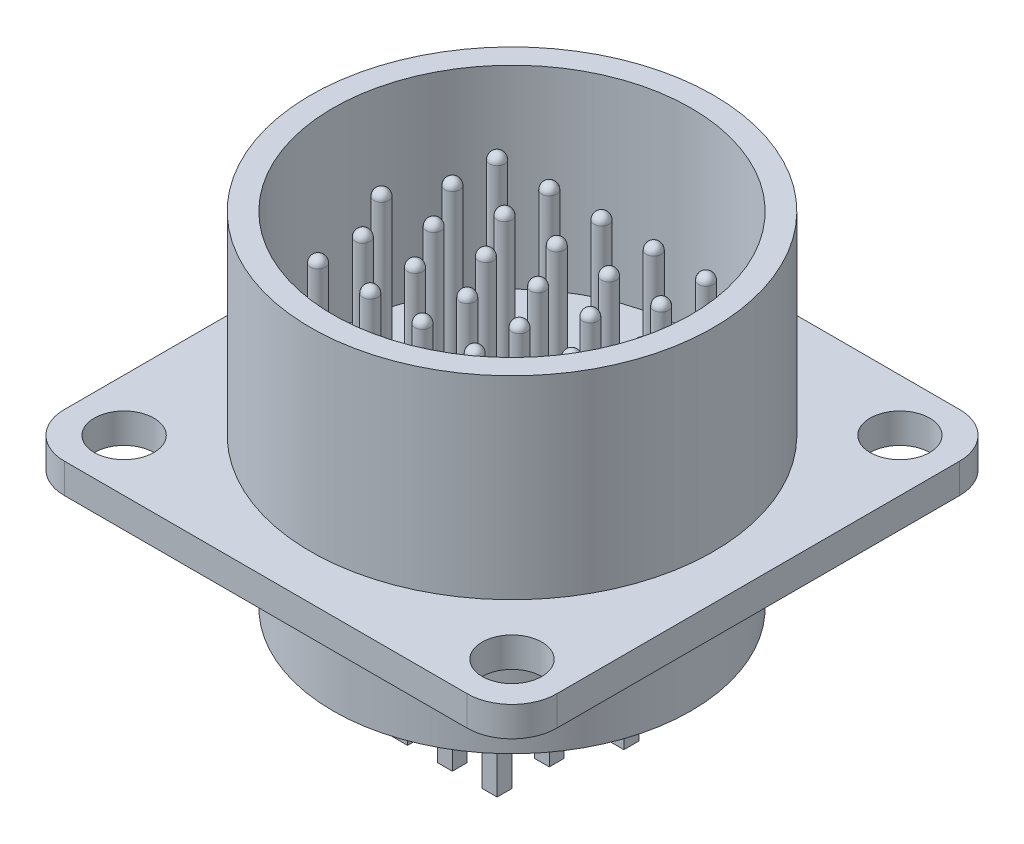
from build123d import *

# Parameters (mm, degrees)
SKETCH_1_R      = 2
EXTRUDE_1_DEPTH = 2
SKETCH_2_R      = 13.5
SKETCH_2_R_2    = 12
EXTRUDE_2_DEPTH = 13
SKETCH_3_R      = 0.5
EXTRUDE_3_DEPTH = 10
EXTRUDE_START   = 8
SKETCH_4_R      = 12
SKETCH_4_R_2    = 10.5
EXTRUDE_4_DEPTH = 8
EXTRUDE_START_2 = 4
SKETCH_5_R      = 10.5
EXTRUDE_5_DEPTH = 4
SKETCH_6_W      = 1
SKETCH_6_H      = 1
EXTRUDE_6_DEPTH = 8
FILLET_3_R      = 0.5


with BuildPart() as part:
    # Эскиз1 → Бобышка-Вытянуть1 (new body)
    with BuildSketch(Plane(origin=(0, 0, 0), x_dir=(1, 0, 0), z_dir=(0, 1, 0))):
        with BuildLine():
            Line((3, 0), (30, 0))
            ThreePointArc((30, 0), (32.121320344, 0.878679656), (33, 3))
            Line((33, 3), (33, 30))
            ThreePointArc((33, 30), (32.121320344, 32.121320344), (30, 33))
            Line((30, 33), (3, 33))
            ThreePointArc((3, 33), (0.878679656, 32.121320344), (0, 30))
            Line((0, 30), (0, 3))
            ThreePointArc((0, 3), (0.878679656, 0.878679656), (3, 0))
        make_face()
        with Locations(Location((3.5, 29.5, 0), (0, 0, 270))):
            Circle(SKETCH_1_R, mode=Mode.SUBTRACT)
        with Locations(Location((29.5, 29.5, 0), (0, 0, 270))):
            Circle(SKETCH_1_R, mode=Mode.SUBTRACT)
        with Locations(Location((3.5, 3.5, 0), (0, 0, 270))):
            Circle(SKETCH_1_R, mode=Mode.SUBTRACT)
        with Locations(Location((29.5, 3.5, 0), (0, 0, 270))):
            Circle(SKETCH_1_R, mode=Mode.SUBTRACT)
    extrude(amount=EXTRUDE_1_DEPTH)

    # Эскиз2 → Бобышка-Вытянуть2 (add)
    with BuildSketch(Plane(origin=(0, 2, 0), x_dir=(1, 0, 0), z_dir=(0, 1, 0))):
        with Locations(Location((16.5, 16.5, 0), (0, 0, 90))):
            Circle(SKETCH_2_R)
        with Locations(Location((16.5, 16.5, 0), (0, 0, 90))):
            Circle(SKETCH_2_R_2, mode=Mode.SUBTRACT)
    extrude(amount=EXTRUDE_2_DEPTH)

    # Эскиз3 → Бобышка-Вытянуть3 (add)
    with BuildSketch(Plane(origin=(0, 2, 0), x_dir=(1, 0, 0), z_dir=(0, 1, 0))):
        with Locations(Location((7.75, 16.5, 0), (0, 0, 270))):
            Circle(SKETCH_3_R)
        with Locations(Location((16.5, 19.5, 0), (0, 0, 270))):
            Circle(SKETCH_3_R)
        with Locations(Location((16.5, 22.5, 0), (0, 0, 270))):
            Circle(SKETCH_3_R)
        with Locations(Location((16.5, 13.5, 0), (0, 0, 270))):
            Circle(SKETCH_3_R)
        with Locations(Location((16.5, 10.5, 0), (0, 0, 270))):
            Circle(SKETCH_3_R)
        with Locations(Location((20, 10.5, 0), (0, 0, 270))):
            Circle(SKETCH_3_R)
        with Locations(Location((20, 13.5, 0), (0, 0, 270))):
            Circle(SKETCH_3_R)
        with Locations(Location((18.25, 16.5, 0), (0, 0, 270))):
            Circle(SKETCH_3_R)
        with Locations(Location((20, 19.5, 0), (0, 0, 270))):
            Circle(SKETCH_3_R)
        with Locations(Location((20, 22.5, 0), (0, 0, 270))):
            Circle(SKETCH_3_R)
        with Locations(Location((23.5, 10.5, 0), (0, 0, 270))):
            Circle(SKETCH_3_R)
        with Locations(Location((23.5, 13.5, 0), (0, 0, 270))):
            Circle(SKETCH_3_R)
        with Locations(Location((21.75, 16.5, 0), (0, 0, 270))):
            Circle(SKETCH_3_R)
        with Locations(Location((23.5, 19.5, 0), (0, 0, 270))):
            Circle(SKETCH_3_R)
        with Locations(Location((23.5, 22.5, 0), (0, 0, 270))):
            Circle(SKETCH_3_R)
        with Locations(Location((13, 10.5, 0), (0, 0, 270))):
            Circle(SKETCH_3_R)
        with Locations(Location((13, 13.5, 0), (0, 0, 270))):
            Circle(SKETCH_3_R)
        with Locations(Location((14.75, 16.5, 0), (0, 0, 270))):
            Circle(SKETCH_3_R)
        with Locations(Location((13, 19.5, 0), (0, 0, 270))):
            Circle(SKETCH_3_R)
        with Locations(Location((13, 22.5, 0), (0, 0, 270))):
            Circle(SKETCH_3_R)
        with Locations(Location((9.5, 10.5, 0), (0, 0, 270))):
            Circle(SKETCH_3_R)
        with Locations(Location((9.5, 13.5, 0), (0, 0, 270))):
            Circle(SKETCH_3_R)
        with Locations(Location((11.25, 16.5, 0), (0, 0, 270))):
            Circle(SKETCH_3_R)
        with Locations(Location((9.5, 19.5, 0), (0, 0, 270))):
            Circle(SKETCH_3_R)
        with Locations(Location((9.5, 22.5, 0), (0, 0, 270))):
            Circle(SKETCH_3_R)
        with Locations(Location((25.25, 16.5, 0), (0, 0, 270))):
            Circle(SKETCH_3_R)
    extrude(amount=EXTRUDE_3_DEPTH)

    # Эскиз4 → Бобышка-Вытянуть4 (add)
    with BuildSketch(Plane.XZ.offset(EXTRUDE_START)):
        with Locations(Location((16.5, -16.5, 0), (0, 0, 270))):
            Circle(SKETCH_4_R)
        with Locations(Location((16.5, -16.5, 0), (0, 0, 270))):
            Circle(SKETCH_4_R_2, mode=Mode.SUBTRACT)
    extrude(amount=-EXTRUDE_4_DEPTH)

    # Эскиз5 → Бобышка-Вытянуть5 (add)
    with BuildSketch(Plane.XZ.offset(EXTRUDE_START_2)):
        with Locations(Location((16.5, -16.5, 0), (0, 0, 270))):
            Circle(SKETCH_5_R)
    extrude(amount=-EXTRUDE_5_DEPTH)

    # Эскиз6 → Бобышка-Вытянуть6 (add)
    with BuildSketch(Plane.XZ.offset(4)):
        with Locations((19.5, -9.5)):
            Rectangle(SKETCH_6_W, SKETCH_6_H)
        with Locations((16.5, -13)):
            Rectangle(SKETCH_6_W, SKETCH_6_H)
        with Locations((16.5, -9.5)):
            Rectangle(SKETCH_6_W, SKETCH_6_H)
        with Locations((16.5, -20)):
            Rectangle(SKETCH_6_W, SKETCH_6_H)
        with Locations((16.5, -23.5)):
            Rectangle(SKETCH_6_W, SKETCH_6_H)
        with Locations((19.5, -13)):
            Rectangle(SKETCH_6_W, SKETCH_6_H)
        with Locations((18, -16.5)):
            Rectangle(SKETCH_6_W, SKETCH_6_H)
        with Locations((19.5, -20)):
            Rectangle(SKETCH_6_W, SKETCH_6_H)
        with Locations((19.5, -23.5)):
            Rectangle(SKETCH_6_W, SKETCH_6_H)
        with Locations((22.5, -9.5)):
            Rectangle(SKETCH_6_W, SKETCH_6_H)
        with Locations((22.5, -13)):
            Rectangle(SKETCH_6_W, SKETCH_6_H)
        with Locations((21, -16.5)):
            Rectangle(SKETCH_6_W, SKETCH_6_H)
        with Locations((22.5, -20)):
            Rectangle(SKETCH_6_W, SKETCH_6_H)
        with Locations((22.5, -23.5)):
            Rectangle(SKETCH_6_W, SKETCH_6_H)
        with Locations((13.5, -9.5)):
            Rectangle(SKETCH_6_W, SKETCH_6_H)
        with Locations((13.5, -13)):
            Rectangle(SKETCH_6_W, SKETCH_6_H)
        with Locations((15, -16.5)):
            Rectangle(SKETCH_6_W, SKETCH_6_H)
        with Locations((13.5, -20)):
            Rectangle(SKETCH_6_W, SKETCH_6_H)
        with Locations((13.5, -23.5)):
            Rectangle(SKETCH_6_W, SKETCH_6_H)
        with Locations((10.5, -9.5)):
            Rectangle(SKETCH_6_W, SKETCH_6_H)
        with Locations((10.5, -13)):
            Rectangle(SKETCH_6_W, SKETCH_6_H)
        with Locations((12, -16.5)):
            Rectangle(SKETCH_6_W, SKETCH_6_H)
        with Locations((10.5, -20)):
            Rectangle(SKETCH_6_W, SKETCH_6_H)
        with Locations((10.5, -23.5)):
            Rectangle(SKETCH_6_W, SKETCH_6_H)
        with Locations((9, -16.5)):
            Rectangle(SKETCH_6_W, SKETCH_6_H)
        with Locations((24, -16.5)):
            Rectangle(SKETCH_6_W, SKETCH_6_H)
    extrude(amount=EXTRUDE_6_DEPTH)

    # Скругление3
    fillet_3_edges = [part.edges().sort_by_distance(p)[0] for p in [
        (13, 12, -20),
        (13, 12, -23),
        (13, 12, -14),
        (13, 12, -11),
        (11.25, 12, -17),
        (9.5, 12, -20),
        (9.5, 12, -23),
        (9.5, 12, -14),
        (9.5, 12, -11),
        (7.75, 12, -17),
        (16.5, 12, -20),
        (16.5, 12, -23),
        (16.5, 12, -14),
        (16.5, 12, -11),
        (18.25, 12, -17),
        (20, 12, -20),
        (20, 12, -23),
        (20, 12, -14),
        (20, 12, -11),
        (21.75, 12, -17),
        (23.5, 12, -20),
        (23.5, 12, -23),
        (23.5, 12, -14),
        (23.5, 12, -11),
        (25.25, 12, -17),
        (14.75, 12, -17),
    ]]
    fillet(fillet_3_edges, radius=FILLET_3_R)


solid = part.part
